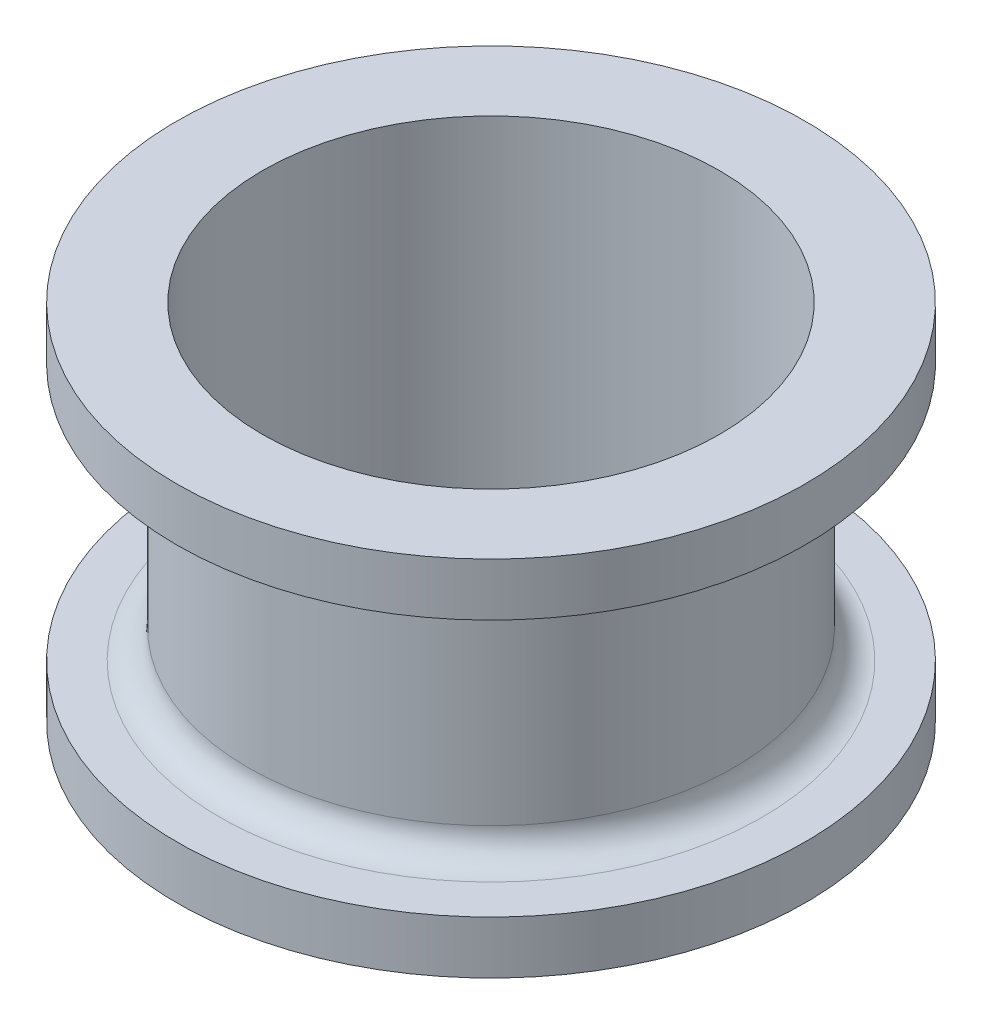
from build123d import *

# Parameters (mm, degrees)
SKETCH1_R           = 8.5
BOSS_EXTRUDE1_DEPTH = 9
SKETCH2_R           = 11
BOSS_EXTRUDE2_DEPTH = 1.85
BOSS_EXTRUDE4_START = 1.85
SKETCH4_R           = 11
BOSS_EXTRUDE4_DEPTH = 1.85
SKETCH5_R           = 8
CUT_EXTRUDE1_DEPTH  = 21.082081565
FILLET1_R           = 1


with BuildPart() as part:
    # Sketch1 → Boss-Extrude1 (new body)
    with BuildSketch(Plane(origin=(0, 0, 0), x_dir=(1, 0, 0), z_dir=(0, 1, 0))):
        with Locations(Location((0, 0, 0), (0, 0, 270))):
            Circle(SKETCH1_R)
    extrude(amount=BOSS_EXTRUDE1_DEPTH)

    # Sketch2 → Boss-Extrude2 (add)
    with BuildSketch(Plane(origin=(0, 9, 0), x_dir=(1, 0, 0), z_dir=(0, 1, 0))):
        with Locations(Location((0, 0, 0), (0, 0, 270))):
            Circle(SKETCH2_R)
    extrude(amount=BOSS_EXTRUDE2_DEPTH)

    # Sketch4 → Boss-Extrude4 (add)
    with BuildSketch(Plane.XZ.offset(BOSS_EXTRUDE4_START)):
        with Locations(Location((0, 0, 0), (0, 0, 90))):
            Circle(SKETCH4_R)
    extrude(amount=-BOSS_EXTRUDE4_DEPTH)

    # Sketch5 → Cut-Extrude1 (cut, through all)
    with BuildSketch(Plane.XZ.offset(1.85)):
        with Locations(Location((0, 0, 0), (0, 0, 270))):
            Circle(SKETCH5_R)
    extrude(amount=-CUT_EXTRUDE1_DEPTH, mode=Mode.SUBTRACT)

    # Fillet1
    fillet1_edges = [part.edges().sort_by_distance(p)[0] for p in [
        (0, 0, -8.5),
        (0, 9, -8.5),
    ]]
    fillet(fillet1_edges, radius=FILLET1_R)


solid = part.part
